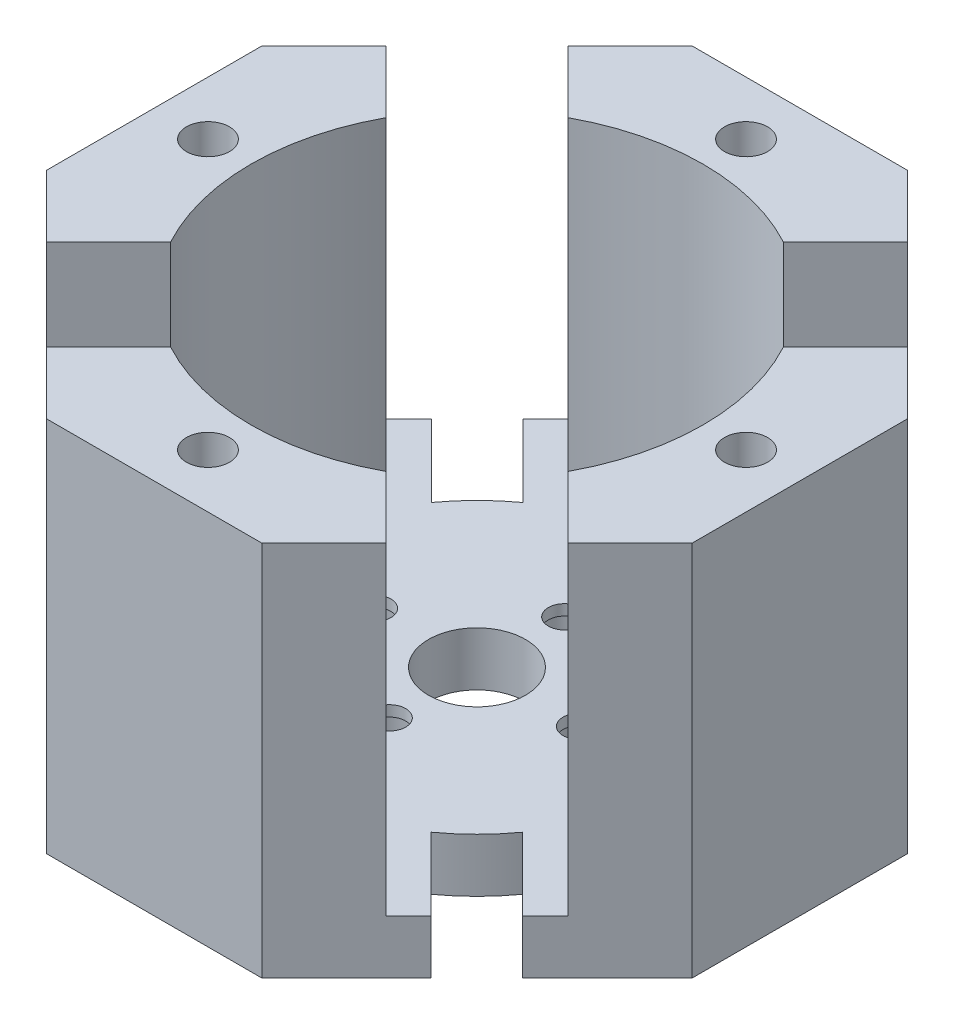
from build123d import *

# Parameters (mm, degrees)
SKETCH1_W                = 60
SKETCH1_H                = 60
BOSS_EXTRUDE1_DEPTH      = 5
SKETCH2_R                = 2
CUT_EXTRUDE2_DEPTH       = 43.720018727
SKETCH8_R                = 4.5
CUT_EXTRUDE4_DEPTH       = 43.720018727
SKETCH31_R               = 1.5
CUT_EXTRUDE20_DEPTH      = 10
SKETCH33_R               = 2.5
CUT_EXTRUDE21_DEPTH      = 3
BOSS_EXTRUDE11_START     = -5
SKETCH35_R               = 4.5
SKETCH35_R_2             = 2
BOSS_EXTRUDE11_DEPTH     = 5
SKETCH37_R               = 1.5
CUT_EXTRUDE22_DEPTH      = 5
SKETCH38_R               = 2.55
CUT_EXTRUDE23_DEPTH      = 4
SKETCH7_R                = 2
CUT_EXTRUDE24_DEPTH      = 10
BOSS_EXTRUDE12_DEPTH     = 30
SKETCH40_R               = 2
CUT_EXTRUDE25_DEPTH      = 6
MIRROR20_COPY_1_SKETCH_R = 2
MIRROR20_COPY_1_DEPTH    = 6
CUT_EXTRUDE27_DEPTH      = 10


with BuildPart() as part:
    # Sketch1 → Boss-Extrude1 (new body)
    with BuildSketch(Plane(origin=(0, 0, 0), x_dir=(1, 0, 0), z_dir=(0, 1, 0))):
        Rectangle(SKETCH1_W, SKETCH1_H)
    extrude(amount=BOSS_EXTRUDE1_DEPTH)

    # Sketch2 → Cut-Extrude2 (cut, through all)
    with BuildSketch(Plane(origin=(0, 5, 0), x_dir=(1, 0, 0), z_dir=(0, 1, 0))):
        with Locations(Location((-16.25, 0, 0), (0, 0, 270))):
            Circle(SKETCH2_R)
        with Locations(Location((16.25, 0, 0), (0, 0, 90))):
            Circle(SKETCH2_R)
        with Locations(Location((0, -16.25, 0), (0, 0, 270))):
            Circle(SKETCH2_R)
        with Locations(Location((0, 16.25, 0), (0, 0, 90))):
            Circle(SKETCH2_R)
    extrude(amount=-CUT_EXTRUDE2_DEPTH, mode=Mode.SUBTRACT)

    # Sketch8 → Cut-Extrude4 (cut, through all)
    with BuildSketch(Plane(origin=(0, 5, 0), x_dir=(1, 0, 0), z_dir=(0, 1, 0))):
        with Locations(Location((0, 0, 0), (0, 0, 270))):
            Circle(SKETCH8_R)
    extrude(amount=-CUT_EXTRUDE4_DEPTH, mode=Mode.SUBTRACT)

    # Sketch31 → Cut-Extrude20 (cut)
    with BuildSketch(Plane(origin=(0, 5, 0), x_dir=(1, 0, 0), z_dir=(0, 1, 0))):
        with Locations(Location((0, 9.5, 0), (0, 0, 270))):
            Circle(SKETCH31_R)
    cut_extrude20 = extrude(amount=-CUT_EXTRUDE20_DEPTH, mode=Mode.SUBTRACT)

    # Sketch33 → Cut-Extrude21 (cut)
    with BuildSketch(Plane.XZ):
        with Locations(Location((0, -9.5, 0), (0, 0, 270))):
            Circle(SKETCH33_R)
    cut_extrude21 = extrude(amount=-CUT_EXTRUDE21_DEPTH, mode=Mode.SUBTRACT)

    # Mirror17: Cut-Extrude20, Cut-Extrude21 across plane
    add(cut_extrude20.mirror(Plane.XY), mode=Mode.SUBTRACT)
    add(cut_extrude21.mirror(Plane.XY), mode=Mode.SUBTRACT)

    # Sketch35 → Boss-Extrude11 (add)
    with BuildSketch(Plane.XZ.offset(BOSS_EXTRUDE11_START)):
        Polygon((-3.829271912, -6.598130063), (-3.829271912, -19.146359559), (3.475800658, -19.146359559), (3.475800658, -6.598130063), (6.745409752, -3.328520969), (18.851800181, -3.328520969), (18.851800181, 3.652536285), (6.745409752, 3.652536285), (3.873455818, 6.524490219), (3.873455818, 19.323095186), (-3.240153156, 19.323095186), (-3.240153156, 7.246160695), (-6.362482561, 3.652536285), (-19.676566439, 3.652536285), (-19.676566439, -3.328520969), (-6.362482561, -3.328520969), align=None)
        with Locations(Location((0, 0, 0), (0, 0, 90))):
            Circle(SKETCH35_R, mode=Mode.SUBTRACT)
        with Locations(Location((-16.25, 0, 0), (0, 0, 90))):
            Circle(SKETCH35_R_2, mode=Mode.SUBTRACT)
        with Locations(Location((0, 16.25, 0), (0, 0, 90))):
            Circle(SKETCH35_R_2, mode=Mode.SUBTRACT)
        with Locations(Location((16.25, 0, 0), (0, 0, 270))):
            Circle(SKETCH35_R_2, mode=Mode.SUBTRACT)
        with Locations(Location((0, -16.25, 0), (0, 0, 270))):
            Circle(SKETCH35_R_2, mode=Mode.SUBTRACT)
    extrude(amount=BOSS_EXTRUDE11_DEPTH)

    # Sketch37 → Cut-Extrude22 (cut)
    with BuildSketch(Plane.XZ):
        with Locations(Location((0, 8.13, 0), (0, 0, 270))):
            Circle(SKETCH37_R)
        with Locations(Location((9.5, 0, 0), (0, 0, 270))):
            Circle(SKETCH37_R)
        with Locations(Location((-9.5, 0, 0), (0, 0, 90))):
            Circle(SKETCH37_R)
        with Locations(Location((0, -8.13, 0), (0, 0, 90))):
            Circle(SKETCH37_R)
    extrude(amount=-CUT_EXTRUDE22_DEPTH, mode=Mode.SUBTRACT)

    # Sketch38 → Cut-Extrude23 (cut)
    with BuildSketch(Plane.XZ):
        with Locations(Location((0, 8.13, 0), (0, 0, 270))):
            Circle(SKETCH38_R)
        with Locations(Location((9.5, 0, 0), (0, 0, 270))):
            Circle(SKETCH38_R)
        with Locations(Location((0, -8.13, 0), (0, 0, 270))):
            Circle(SKETCH38_R)
        with Locations(Location((-9.5, 0, 0), (0, 0, 270))):
            Circle(SKETCH38_R)
    extrude(amount=-CUT_EXTRUDE23_DEPTH, mode=Mode.SUBTRACT)

    # Sketch7 → Cut-Extrude24 (cut)
    with BuildSketch(Plane(origin=(0, 5, 0), x_dir=(1, 0, 0), z_dir=(0, 1, 0))):
        with Locations(Location((-25, 0, 0), (0, 0, 270))):
            Circle(SKETCH7_R)
        with Locations(Location((0, 25, 0), (0, 0, 270))):
            Circle(SKETCH7_R)
        with Locations(Location((25, 0, 0), (0, 0, 270))):
            Circle(SKETCH7_R)
        with Locations(Location((0, -25, 0), (0, 0, 270))):
            Circle(SKETCH7_R)
        Polygon((-30, 30), (-30, 10), (-10, 30), align=None)
        Polygon((30, 30), (30, 10), (10, 30), align=None)
        Polygon((30, -30), (10, -30), (30, -10), align=None)
        Polygon((-30, -30), (-30, -10), (-10, -30), align=None)
    extrude(amount=-CUT_EXTRUDE24_DEPTH, mode=Mode.SUBTRACT)

    # Sketch39 → Boss-Extrude12 (add)
    with BuildSketch(Plane(origin=(0, 5, 0), x_dir=(1, 0, 0), z_dir=(0, 1, 0))):
        with BuildLine():
            Line((-10, 30), (10, 30))
            Line((10, 30), (15.766907344, 24.233092656))
            Line((15.766907344, 24.233092656), (10, 18.466185313))
            ThreePointArc((10, 18.466185313), (0, 21), (-10, 18.466185313))
            Line((-10, 18.466185313), (-15.766907344, 24.233092656))
            Line((-15.766907344, 24.233092656), (-10, 30))
        make_face()
        with BuildLine():
            Line((30, 10), (30, -10))
            Line((30, -10), (24.233092656, -15.766907344))
            Line((24.233092656, -15.766907344), (18.466185313, -10))
            ThreePointArc((18.466185313, -10), (21, 0), (18.466185313, 10))
            Line((18.466185313, 10), (24.233092656, 15.766907344))
            Line((24.233092656, 15.766907344), (30, 10))
        make_face()
        with BuildLine():
            Line((10, -30), (-10, -30))
            Line((-10, -30), (-15.766907344, -24.233092656))
            Line((-15.766907344, -24.233092656), (-10, -18.466185313))
            ThreePointArc((-10, -18.466185313), (0, -21), (10, -18.466185313))
            Line((10, -18.466185313), (15.766907344, -24.233092656))
            Line((15.766907344, -24.233092656), (10, -30))
        make_face()
        with BuildLine():
            Line((-30, -10), (-30, 10))
            Line((-30, 10), (-24.233092656, 15.766907344))
            Line((-24.233092656, 15.766907344), (-18.466185313, 10))
            ThreePointArc((-18.466185313, 10), (-21, 0), (-18.466185313, -10))
            Line((-18.466185313, -10), (-24.233092656, -15.766907344))
            Line((-24.233092656, -15.766907344), (-30, -10))
        make_face()
    extrude(amount=BOSS_EXTRUDE12_DEPTH)

    # Sketch40 → Cut-Extrude25 (cut)
    with BuildSketch(Plane(origin=(0, 35, 0), x_dir=(1, 0, 0), z_dir=(0, 1, 0))):
        with Locations(Location((-25, 0, 0), (0, 0, 270))):
            Circle(SKETCH40_R)
    cut_extrude25 = extrude(amount=-CUT_EXTRUDE25_DEPTH, mode=Mode.SUBTRACT)

    # Mirror19: Cut-Extrude25 across plane
    add(cut_extrude25.mirror(Plane(origin=(0, 0, 0), x_dir=(0, 0, 1), z_dir=(1, 0, 0))), mode=Mode.SUBTRACT)

    # Mirror20: Cut-Extrude25 across plane
    add(cut_extrude25.mirror(Plane(origin=(0, 0, 0), x_dir=(0.7071067811865478, 0, 0.7071067811865472), z_dir=(0.7071067811865475, 0, -0.7071067811865477))), mode=Mode.SUBTRACT)

    # Mirror20 copy 1 sketch → Mirror20 copy 1 (cut)
    with BuildSketch(Plane(origin=(0, 35, 0), x_dir=(0, 0, -1), z_dir=(0, 1, 0))):
        with Locations(Location((-25, 0, 0), (0, 0, 270))):
            Circle(MIRROR20_COPY_1_SKETCH_R)
    extrude(amount=-MIRROR20_COPY_1_DEPTH, mode=Mode.SUBTRACT)

    # Sketch42 → Cut-Extrude27 (cut)
    with BuildSketch(Plane(origin=(0, 5, 0), x_dir=(1, 0, 0), z_dir=(0, 1, 0))):
        with BuildLine():
            Line((-22.116546328, 17.883453672), (-15.383807976, 11.15071532))
            ThreePointArc((-15.383807976, 11.15071532), (-13.430193311, 13.439862634), (-11.139640554, 15.391829272))
            Line((-11.139640554, 15.391829272), (-17.873905641, 22.126094359))
            Line((-17.873905641, 22.126094359), (-22.116546328, 17.883453672))
        make_face()
        with BuildLine():
            Line((22.126094359, 17.873905641), (17.883453672, 22.116546328))
            Line((17.883453672, 22.116546328), (11.15071532, 15.383807976))
            ThreePointArc((11.15071532, 15.383807976), (13.439862634, 13.430193311), (15.391829272, 11.139640554))
            Line((15.391829272, 11.139640554), (22.126094359, 17.873905641))
        make_face()
        with BuildLine():
            Line((17.873905641, -22.126094359), (22.116546328, -17.883453672))
            Line((22.116546328, -17.883453672), (15.383807976, -11.15071532))
            ThreePointArc((15.383807976, -11.15071532), (13.430193311, -13.439862634), (11.139640554, -15.391829272))
            Line((11.139640554, -15.391829272), (17.873905641, -22.126094359))
        make_face()
        with BuildLine():
            Line((-22.126094359, -17.873905641), (-17.883453672, -22.116546328))
            Line((-17.883453672, -22.116546328), (-11.15071532, -15.383807976))
            ThreePointArc((-11.15071532, -15.383807976), (-13.439862634, -13.430193311), (-15.391829272, -11.139640554))
            Line((-15.391829272, -11.139640554), (-22.126094359, -17.873905641))
        make_face()
    extrude(amount=-CUT_EXTRUDE27_DEPTH, mode=Mode.SUBTRACT)


solid = part.part
